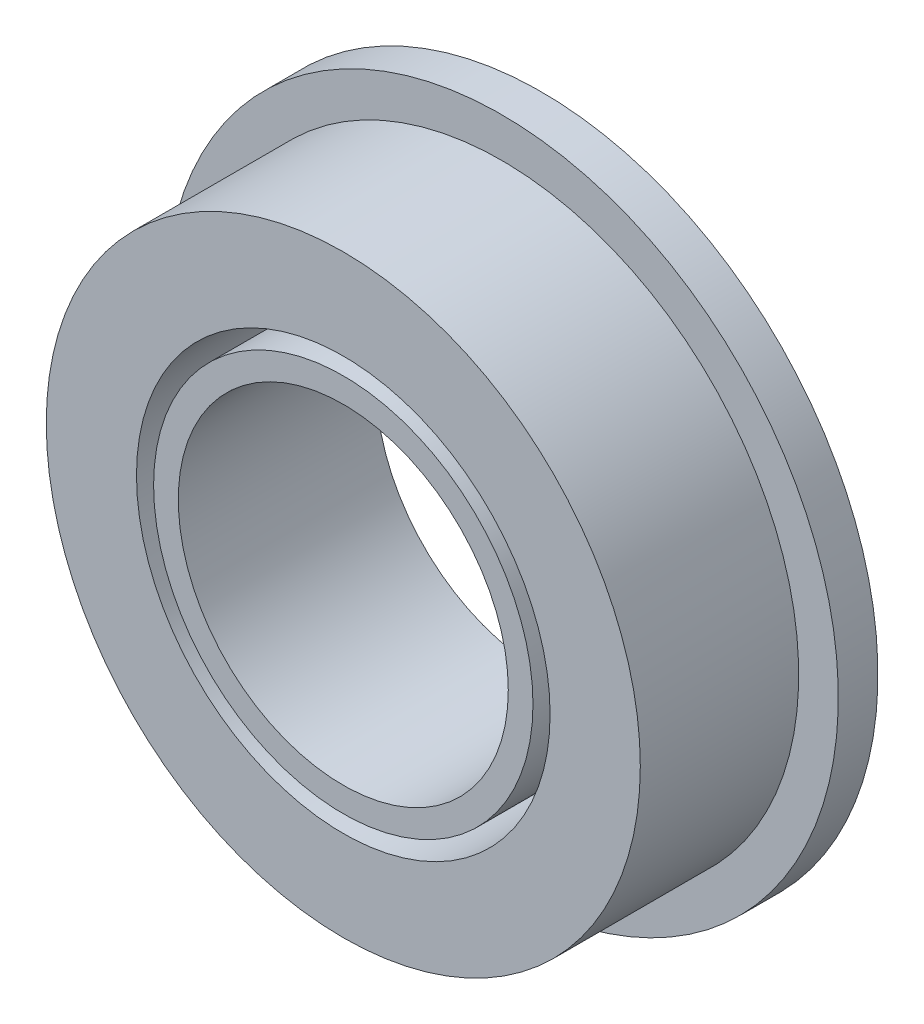
from build123d import *

# Parameters (mm, degrees)
SKETCH1_R           = 4.5
SKETCH1_R_2         = 2.5
BOSS_EXTRUDE1_DEPTH = 3
SKETCH2_R           = 5.1
SKETCH2_R_2         = 2.5
BOSS_EXTRUDE2_DEPTH = 0.6
SKETCH3_R           = 3.133161095
SKETCH3_R_2         = 2.873951896
CUT_EXTRUDE1_DEPTH  = 6.6


with BuildPart() as part:
    # Sketch1 → Boss-Extrude1 (new body)
    with BuildSketch(Plane.XY):
        Circle(SKETCH1_R)
        Circle(SKETCH1_R_2, mode=Mode.SUBTRACT)
    extrude(amount=BOSS_EXTRUDE1_DEPTH)

    # Sketch2 → Boss-Extrude2 (add)
    with BuildSketch(Plane(origin=(0, 0, 0), x_dir=(-1, 0, 0), z_dir=(0, 0, -1))):
        Circle(SKETCH2_R)
        with Locations(Location((0, 0, 0), (0, 0, 180))):
            Circle(SKETCH2_R_2, mode=Mode.SUBTRACT)
    extrude(amount=-BOSS_EXTRUDE2_DEPTH)

    # Sketch3 → Cut-Extrude1 (cut)
    with BuildSketch(Plane(origin=(0, 0, 0), x_dir=(-1, 0, 0), z_dir=(0, 0, -1))):
        Circle(SKETCH3_R)
        Circle(SKETCH3_R_2, mode=Mode.SUBTRACT)
    extrude(amount=-CUT_EXTRUDE1_DEPTH, mode=Mode.SUBTRACT)


with BuildPart() as cut_extrude1_piece_1:
    # of the separate pieces the step leaves, piece 1, a body of its own (cut_extrude1_pieces)
    add(part.part.solids().sort_by_distance((-5.1, 0, 0))[0])


with BuildPart() as cut_extrude1_piece_2:
    # of the separate pieces the step leaves, piece 2, a body of its own (cut_extrude1_pieces)
    add(part.part.solids().sort_by_distance((-2.873951896, 0, 0))[0])


solid = Compound([cut_extrude1_piece_1.part, cut_extrude1_piece_2.part])
